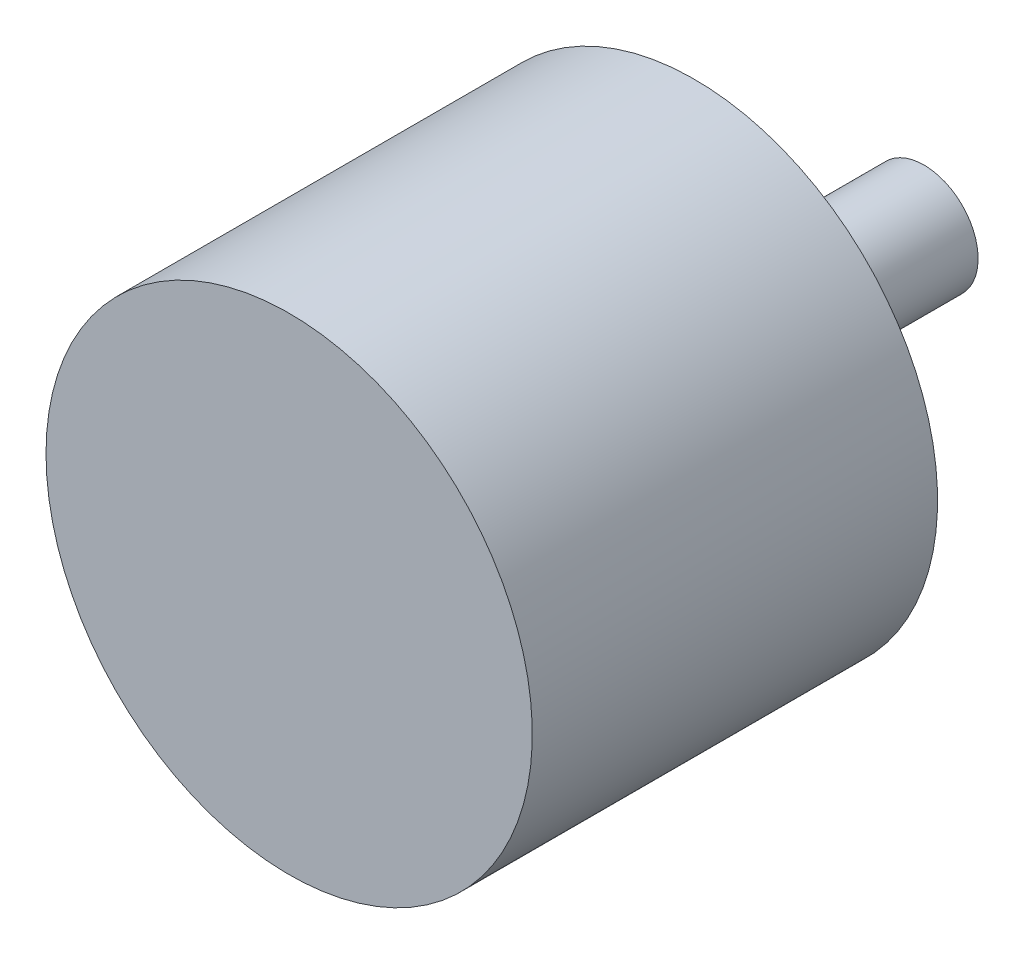
from build123d import *

# Parameters (mm, degrees)
F_3_5_3_5_DIAMETER_HOLE1_D     = 3.5
F_3_5_3_5_DIAMETER_HOLE1_DEPTH = 5


with BuildPart() as part:
    # Sketch2 → Revolve1 (revolve)
    with BuildSketch(Plane.XZ, mode=Mode.PRIVATE) as revolve1_sk:
        Polygon((18, 30), (0, 30), (0, -17), (4, -17), (4, 0), (18, 0), align=None)
    revolve(revolve1_sk.sketch.rotate(Axis((0, 0, 30), (0, 0, -1)), 180), axis=Axis((0, 0, 30), (0, 0, -1)))

    # Ø3.5 (3.5) Diameter Hole1
    with Locations(Plane(origin=(0, 0, 0), x_dir=(-1, 0, 0), z_dir=(0, 0, -1))):
        with Locations((9.899494937, 9.899494937), (-9.899494937, -9.899494937), (9.899494937, -9.899494937), (-9.899494937, 9.899494937)):
            Hole(F_3_5_3_5_DIAMETER_HOLE1_D / 2, depth=F_3_5_3_5_DIAMETER_HOLE1_DEPTH)


solid = part.part
